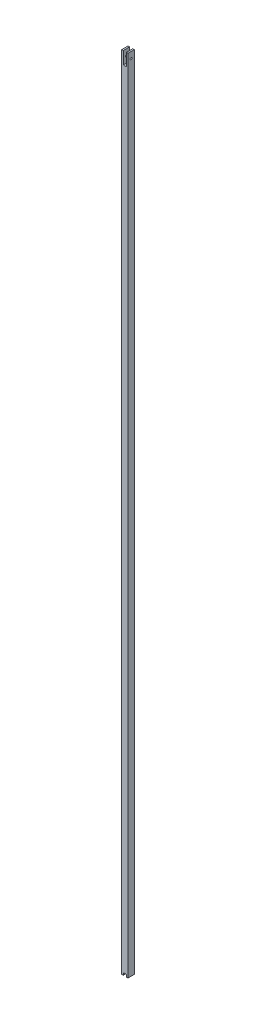
from build123d import *

# Parameters (mm, degrees)
BOSS_EXTRUDE1_DEPTH = 6.35
SKETCH3_R           = 1
CUT_EXTRUDE3_DEPTH  = 10


with BuildPart() as part:
    # Sketch1 → Boss-Extrude1 (new body)
    with BuildSketch(Plane.XY):
        Polygon((0, 0), (1.5875, 0), (1.5875, 2.38125), (4.7625, 2.38125), (4.7625, 0), (6.35, 0), (6.35, 812.8), (4.7625, 812.8), (4.7625, 800.1), (1.5875, 800.1), (1.5875, 812.8), (0, 812.8), align=None)
    extrude(amount=BOSS_EXTRUDE1_DEPTH)

    # Sketch3 → Cut-Extrude3 (cut, symmetric)
    with BuildSketch(Plane(origin=(0, 0, 0), x_dir=(0, 0, -1), z_dir=(1, 0, 0))):
        with Locations((-3.175, 806.45)):
            Circle(SKETCH3_R)
    extrude(amount=CUT_EXTRUDE3_DEPTH, both=True, mode=Mode.SUBTRACT)


solid = part.part
